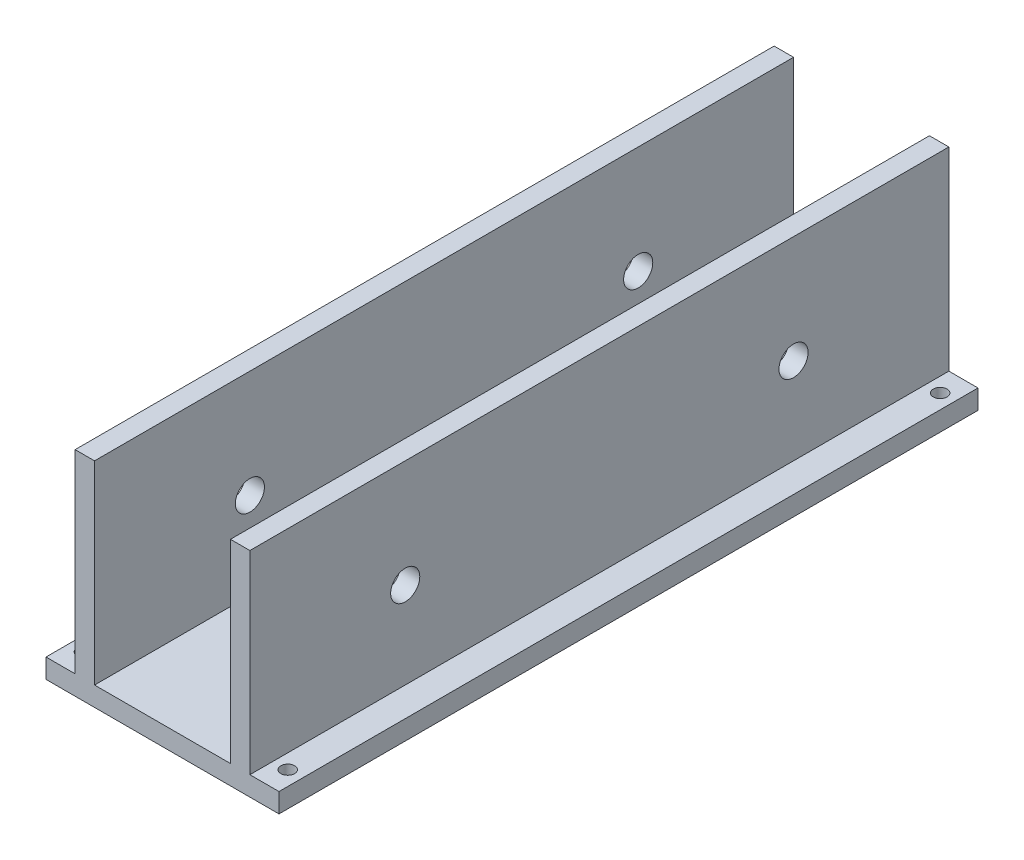
from build123d import *

# Parameters (mm, degrees)
BOSS_EXTRUDE1_DEPTH = 228.6
SKETCH4_R           = 2.2479
CUT_EXTRUDE1_DEPTH  = 250.191994253
SKETCH5_R           = 4.7625
CUT_EXTRUDE2_DEPTH  = 249.158292477


with BuildPart() as part:
    # Sketch1 → Boss-Extrude1 (new body)
    with BuildSketch(Plane.XY):
        Polygon((0, 0), (76.2, 0), (76.2, 6.35), (66.675, 6.35), (66.675, 69.85), (60.325, 69.85), (60.325, 6.35), (15.875, 6.35), (15.875, 69.85), (9.525, 69.85), (9.525, 6.35), (0, 6.35), align=None)
    extrude(amount=BOSS_EXTRUDE1_DEPTH)

    # Sketch4 → Cut-Extrude1 (cut, through all)
    with BuildSketch(Plane(origin=(0, 6.35, 0), x_dir=(1, 0, 0), z_dir=(0, 1, 0))):
        with Locations(Location((4.7625, -7.62, 0), (0, 0, 180))):
            Circle(SKETCH4_R)
        with Locations(Location((4.7625, -220.98, 0), (0, 0, 180))):
            Circle(SKETCH4_R)
        with Locations((71.4375, -220.98)):
            Circle(SKETCH4_R)
        with Locations((71.4375, -7.62)):
            Circle(SKETCH4_R)
    extrude(amount=-CUT_EXTRUDE1_DEPTH, mode=Mode.SUBTRACT)

    # Sketch5 → Cut-Extrude2 (cut, through all)
    with BuildSketch(Plane(origin=(66.675, 0, 0), x_dir=(0, 0, -1), z_dir=(1, 0, 0))):
        with Locations(Location((-177.8, 34.676908919, 0), (0, 0, 90))):
            Circle(SKETCH5_R)
        with Locations(Location((-50.8, 34.676908919, 0), (0, 0, 90))):
            Circle(SKETCH5_R)
    extrude(amount=-CUT_EXTRUDE2_DEPTH, mode=Mode.SUBTRACT)


solid = part.part
